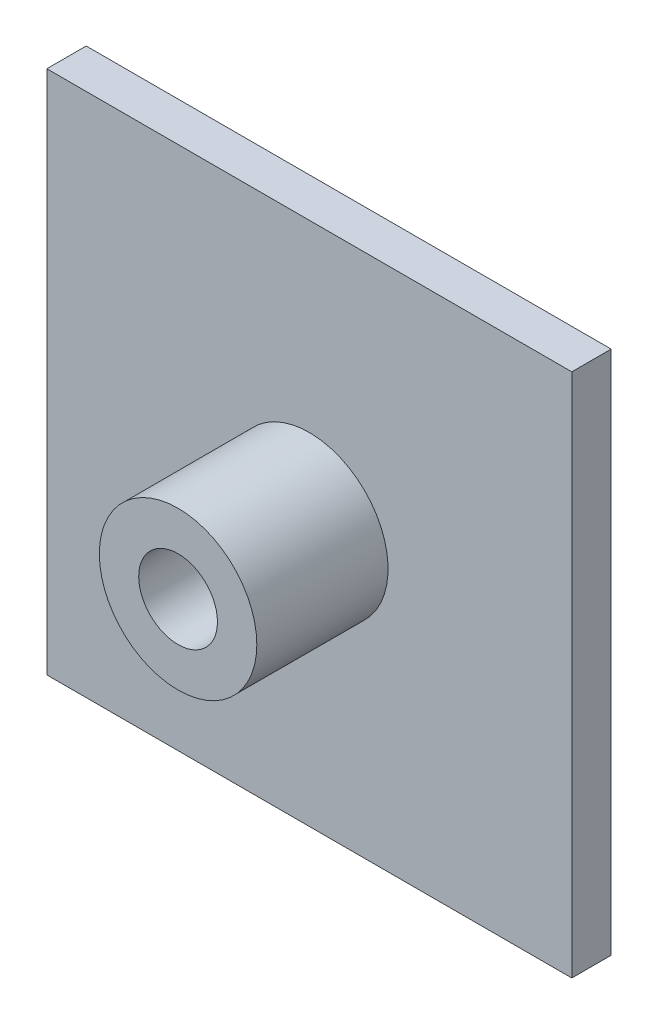
from build123d import *

# Parameters (mm, degrees)
SKETCH_2_W        = 20
SKETCH_2_H        = 20
SKETCH_2_R        = 1.5
EXTRUDE_433_DEPTH = 1.5
SKETCH_3_R        = 3
SKETCH_3_R_2      = 1.5
EXTRUDE_659_DEPTH = 5
CHAMFER_1_SIZE    = 1.5


with BuildPart() as part:
    # Эскиз2 → Extrude 433 (new body)
    with BuildSketch(Plane.XY):
        Rectangle(SKETCH_2_W, SKETCH_2_H)
        Circle(SKETCH_2_R, mode=Mode.SUBTRACT)
    extrude(amount=EXTRUDE_433_DEPTH)

    # Эскиз3 → Extrude 659 (add)
    with BuildSketch(Plane.XY.offset(1.5)):
        with Locations(Location((0, 0, 0), (0, 0, 180))):
            Circle(SKETCH_3_R)
        Circle(SKETCH_3_R_2, mode=Mode.SUBTRACT)
    extrude(amount=EXTRUDE_659_DEPTH)

    # Фаска1
    chamfer_1_edges = [part.edges().sort_by_distance(p)[0] for p in [
        (-1.5, 0, 0),
    ]]
    chamfer(chamfer_1_edges, length=CHAMFER_1_SIZE)


solid = part.part
